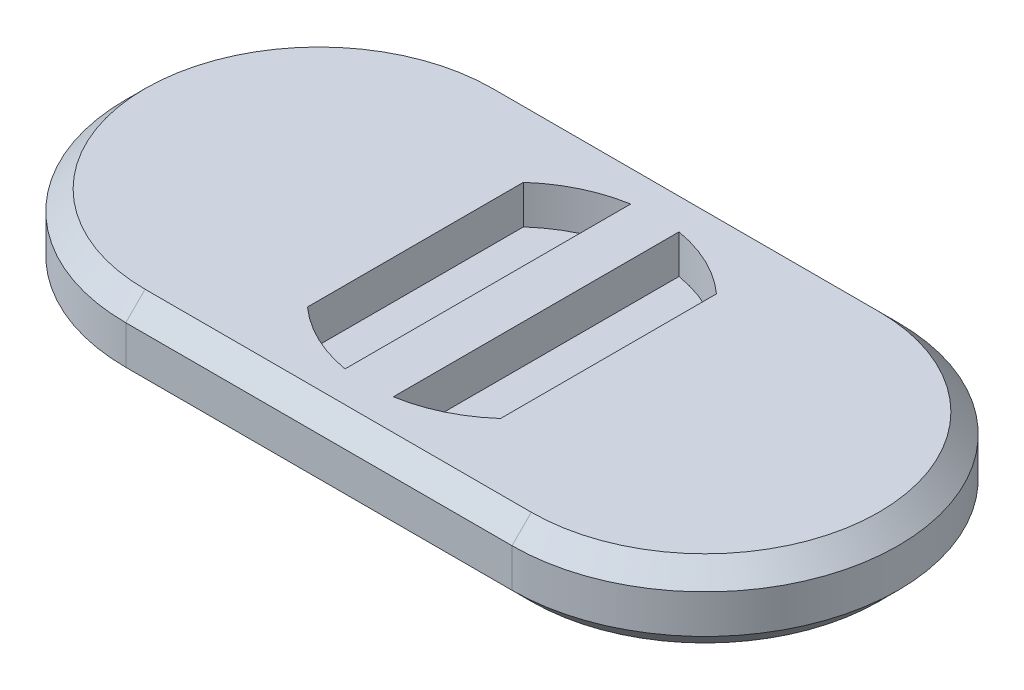
from build123d import *

# Parameters (mm, degrees)
BOSS_EXTRUDE1_DEPTH = 8
CUT_EXTRUDE5_DEPTH  = 4
CHAMFER1_SIZE       = 2


with BuildPart() as part:
    # Sketch1 → Boss-Extrude1 (new body)
    with BuildSketch(Plane(origin=(0, 0, 0), x_dir=(1, 0, 0), z_dir=(0, 1, 0))):
        with BuildLine():
            Line((-20, 20), (20, 20))
            ThreePointArc((20, 20), (40, 0), (20, -20))
            Line((20, -20), (-20, -20))
            ThreePointArc((-20, -20), (-40, 0), (-20, 20))
        make_face()
    extrude(amount=BOSS_EXTRUDE1_DEPTH)

    # Sketch2 → Cut-Extrude5 (cut)
    with BuildSketch(Plane(origin=(0, 8, 0), x_dir=(1, 0, 0), z_dir=(0, 1, 0))):
        with BuildLine():
            Line((-10, -11.180339887), (-10, 11.180339887))
            ThreePointArc((-10, 11.180339887), (-6.505403256, 13.515906498), (-2.5, 14.790199458))
            Line((-2.5, 14.790199458), (-2.5, -14.790199458))
            ThreePointArc((-2.5, -14.790199458), (-6.505403256, -13.515906498), (-10, -11.180339887))
        make_face()
        with BuildLine():
            Line((10, -11.180339887), (10, 11.180339887))
            ThreePointArc((10, 11.180339887), (6.505403256, 13.515906498), (2.5, 14.790199458))
            Line((2.5, 14.790199458), (2.5, -14.790199458))
            ThreePointArc((2.5, -14.790199458), (6.505403256, -13.515906498), (10, -11.180339887))
        make_face()
    extrude(amount=-CUT_EXTRUDE5_DEPTH, mode=Mode.SUBTRACT)

    # Chamfer1
    chamfer1_edges = [part.edges().sort_by_distance(p)[0] for p in [
        (40, 8, 0),
        (0, 8, -20),
        (-40, 8, 0),
        (0, 0, -20),
        (40, 0, 0),
        (0, 0, 20),
        (-40, 0, 0),
        (0, 8, 20),
    ]]
    chamfer(chamfer1_edges, length=CHAMFER1_SIZE)


solid = part.part
